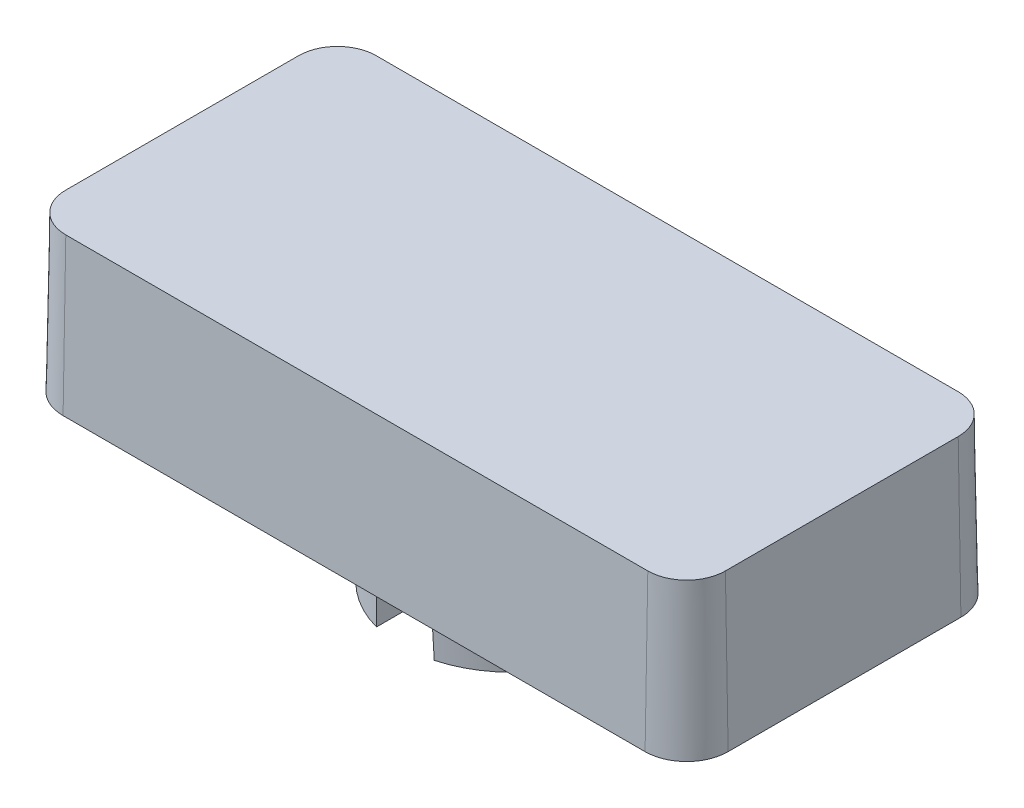
from build123d import *

# Parameters (mm, degrees)
BOSS_EXTRUDE1_DEPTH           = 4
BOSS_EXTRUDE1_DRAFT           = 1
SHELL1_T                      = -0.5
BOSS_EXTRUDE2_DEPTH           = 5.5
BOSS_EXTRUDE2_DRAFT           = 1.5
BOSS_EXTRUDE2_PROFILE_2_DEPTH = 5.5
BOSS_EXTRUDE2_PROFILE_2_DRAFT = 1.5
BOSS_EXTRUDE2_PROFILE_3_DEPTH = 5.5
BOSS_EXTRUDE2_PROFILE_3_DRAFT = 1.5
BOSS_EXTRUDE2_PROFILE_4_DEPTH = 5.5
BOSS_EXTRUDE2_PROFILE_4_DRAFT = 1.5


with BuildPart() as part:
    # Sketch1 → Boss-Extrude1 (with draft: the straight prism first)
    with BuildSketch(Plane(origin=(0, 0, 0), x_dir=(1, 0, 0), z_dir=(0, 1, 0))):
        with BuildLine():
            Line((-7.5, -4), (7.5, -4))
            ThreePointArc((7.5, -4), (8.207106781, -3.707106781), (8.5, -3))
            Line((8.5, -3), (8.5, 3))
            ThreePointArc((8.5, 3), (8.207106781, 3.707106781), (7.5, 4))
            Line((7.5, 4), (-7.5, 4))
            ThreePointArc((-7.5, 4), (-8.207106781, 3.707106781), (-8.5, 3))
            Line((-8.5, 3), (-8.5, -3))
            ThreePointArc((-8.5, -3), (-8.207106781, -3.707106781), (-7.5, -4))
        make_face()
    extrude(amount=-BOSS_EXTRUDE1_DEPTH)
    # Boss-Extrude1: the draft: its side faces are tilted about the plane it starts from
    boss_extrude1_sides = [part.faces().sort_by_distance(p)[0] for p in [
        (0, -2, 4),
        (8.207106781, -2, 3.707106781),
        (8.5, -2, 0),
        (8.207106781, -2, -3.707106781),
        (0, -2, -4),
        (-8.207106781, -2, -3.707106781),
        (-8.5, -2, 0),
        (-8.207106781, -2, 3.707106781),
    ]]
    draft(boss_extrude1_sides, Plane(origin=(0, 0, 0), x_dir=(1, 0, 0), z_dir=(0, 1, 0)), BOSS_EXTRUDE1_DRAFT)

    # Shell1
    shell1_openings = [part.faces().sort_by_distance(p)[0] for p in [
        (0, -4, 0),
    ]]
    offset(amount=SHELL1_T, openings=shell1_openings, kind=Kind.INTERSECTION)


with BuildPart() as boss_extrude2_tool:
    # Sketch2 → Boss-Extrude2 (with draft: the straight prism first)
    with BuildSketch(Plane.XZ.offset(0.5)):
        with BuildLine():
            ThreePointArc((-0.6, 2.93078798), (-2.115362638, 2.115362638), (-2.93078798, 0.6))
            Line((-2.93078798, 0.6), (-0.6, 0.6))
            Line((-0.6, 0.6), (-0.6, 2.93078798))
        make_face()
    extrude(amount=BOSS_EXTRUDE2_DEPTH)
    # Boss-Extrude2: the draft: its side faces are tilted about the plane it starts from
    boss_extrude2_sides = [boss_extrude2_tool.faces().sort_by_distance(p)[0] for p in [
        (-2.115362638, -3.25, 2.115362638),
        (-1.76539399, -3.25, 0.6),
        (-0.6, -3.25, 1.76539399),
    ]]
    draft(boss_extrude2_sides, Plane.XZ.offset(0.5), BOSS_EXTRUDE2_DRAFT)


with BuildPart() as part_1:
    add(part.part)

    # Boss-Extrude2: add boss_extrude2_tool
    add(boss_extrude2_tool.part)


with BuildPart() as boss_extrude2_profile_2_tool:
    # Sketch2 → Boss-Extrude2 profile 2 (with draft: the straight prism first)
    with BuildSketch(Plane.XZ.offset(0.5)):
        with BuildLine():
            ThreePointArc((-2.93078798, -0.6), (-2.115362638, -2.115362638), (-0.6, -2.93078798))
            Line((-0.6, -2.93078798), (-0.6, -0.6))
            Line((-0.6, -0.6), (-2.93078798, -0.6))
        make_face()
    extrude(amount=BOSS_EXTRUDE2_PROFILE_2_DEPTH)
    # Boss-Extrude2 profile 2: the draft: its side faces are tilted about the plane it starts from
    boss_extrude2_profile_2_sides = [boss_extrude2_profile_2_tool.faces().sort_by_distance(p)[0] for p in [
        (-2.115362638, -3.25, -2.115362638),
        (-0.6, -3.25, -1.76539399),
        (-1.76539399, -3.25, -0.6),
    ]]
    draft(boss_extrude2_profile_2_sides, Plane.XZ.offset(0.5), BOSS_EXTRUDE2_PROFILE_2_DRAFT)


with BuildPart() as part_2:
    add(part_1.part)

    # Boss-Extrude2 profile 2: add boss_extrude2_profile_2_tool
    add(boss_extrude2_profile_2_tool.part)


with BuildPart() as boss_extrude2_profile_3_tool:
    # Sketch2 → Boss-Extrude2 profile 3 (with draft: the straight prism first)
    with BuildSketch(Plane.XZ.offset(0.5)):
        with BuildLine():
            Line((0.6, 2.93078798), (0.6, 0.6))
            Line((0.6, 0.6), (2.93078798, 0.6))
            ThreePointArc((2.93078798, 0.6), (2.115362638, 2.115362638), (0.6, 2.93078798))
        make_face()
    extrude(amount=BOSS_EXTRUDE2_PROFILE_3_DEPTH)
    # Boss-Extrude2 profile 3: the draft: its side faces are tilted about the plane it starts from
    boss_extrude2_profile_3_sides = [boss_extrude2_profile_3_tool.faces().sort_by_distance(p)[0] for p in [
        (2.115362638, -3.25, 2.115362638),
        (0.6, -3.25, 1.76539399),
        (1.76539399, -3.25, 0.6),
    ]]
    draft(boss_extrude2_profile_3_sides, Plane.XZ.offset(0.5), BOSS_EXTRUDE2_PROFILE_3_DRAFT)


with BuildPart() as part_3:
    add(part_2.part)

    # Boss-Extrude2 profile 3: add boss_extrude2_profile_3_tool
    add(boss_extrude2_profile_3_tool.part)


with BuildPart() as boss_extrude2_profile_4_tool:
    # Sketch2 → Boss-Extrude2 profile 4 (with draft: the straight prism first)
    with BuildSketch(Plane.XZ.offset(0.5)):
        with BuildLine():
            Line((0.6, -0.6), (0.6, -2.93078798))
            ThreePointArc((0.6, -2.93078798), (2.115362638, -2.115362638), (2.93078798, -0.6))
            Line((2.93078798, -0.6), (0.6, -0.6))
        make_face()
    extrude(amount=BOSS_EXTRUDE2_PROFILE_4_DEPTH)
    # Boss-Extrude2 profile 4: the draft: its side faces are tilted about the plane it starts from
    boss_extrude2_profile_4_sides = [boss_extrude2_profile_4_tool.faces().sort_by_distance(p)[0] for p in [
        (1.76539399, -3.25, -0.6),
        (0.6, -3.25, -1.76539399),
        (2.115362638, -3.25, -2.115362638),
    ]]
    draft(boss_extrude2_profile_4_sides, Plane.XZ.offset(0.5), BOSS_EXTRUDE2_PROFILE_4_DRAFT)


with BuildPart() as part_4:
    add(part_3.part)

    # Boss-Extrude2 profile 4: add boss_extrude2_profile_4_tool
    add(boss_extrude2_profile_4_tool.part)


solid = part_4.part
